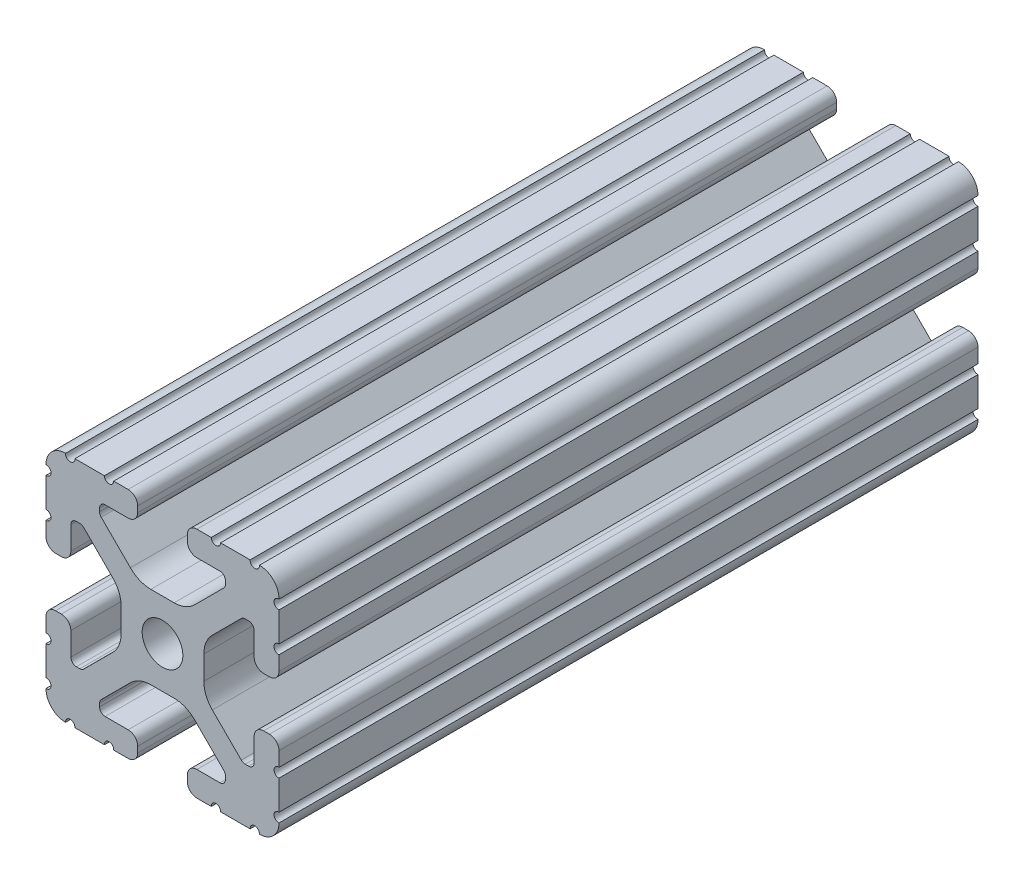
from build123d import *

# Parameters (mm, degrees)
SKETCH1_R      = 3.3274
EXTRUDE1_DEPTH = 114.3


with BuildPart() as part:
    # Sketch1 → Extrude1 (new body)
    with BuildSketch(Plane.XY):
        with BuildLine():
            Line((-10.022898969, 12.91475973), (-5.252158105, 8.144007132))
            ThreePointArc((-5.252158105, 8.144007132), (-3.715177372, 7.117027388), (-1.902183975, 6.7564))
            Line((-1.902183975, 6.7564), (1.902183975, 6.7564))
            ThreePointArc((1.902183975, 6.7564), (3.715177372, 7.117027388), (5.252158105, 8.144007132))
            Line((5.252158105, 8.144007132), (10.022898969, 12.91475973))
            ThreePointArc((10.022898969, 12.91475973), (10.218362387, 13.207291992), (10.287, 13.552357131))
            Line((10.287, 13.552357131), (10.287, 14.0843))
            ThreePointArc((10.287, 14.0843), (10.022898185, 14.721898185), (9.3853, 14.986))
            Line((9.3853, 14.986), (5.617617549, 14.986))
            ThreePointArc((5.617617549, 14.986), (4.519044045, 15.441044045), (4.064, 16.539617549))
            Line((4.064, 16.539617549), (4.064, 17.496382451))
            ThreePointArc((4.064, 17.496382451), (4.519044045, 18.594955955), (5.617617549, 19.05))
            Line((5.617617549, 19.05), (7.974178704, 19.05))
            ThreePointArc((7.974178704, 19.05), (8.736178704, 18.288), (9.498178704, 19.05))
            Line((9.498178704, 19.05), (14.327719207, 19.05))
            ThreePointArc((14.327719207, 19.05), (15.087603123, 18.231251131), (15.847487039, 19.05))
            ThreePointArc((15.847487039, 19.05), (18.120176289, 18.120192083), (19.05, 15.847509295))
            ThreePointArc((19.05, 15.847509295), (18.231250992, 15.08762539), (19.05, 14.327741484))
            Line((19.05, 14.327741484), (19.05, 9.496091471))
            ThreePointArc((19.05, 9.496091471), (18.231250992, 8.736207565), (19.05, 7.97632366))
            Line((19.05, 7.97632366), (19.05, 5.617617549))
            ThreePointArc((19.05, 5.617617549), (18.594955955, 4.519044045), (17.496382451, 4.064))
            Line((17.496382451, 4.064), (16.539617549, 4.064))
            ThreePointArc((16.539617549, 4.064), (15.441044045, 4.519044045), (14.986, 5.617617549))
            Line((14.986, 5.617617549), (14.986, 9.385342516))
            ThreePointArc((14.986, 9.385342516), (14.721898185, 10.022940701), (14.0843, 10.287042516))
            Line((14.0843, 10.287042516), (13.516042086, 10.287042516))
            ThreePointArc((13.516042086, 10.287042516), (13.170975923, 10.218404478), (12.878443117, 10.022939917))
            Line((12.878443117, 10.022939917), (8.14758008, 5.292065243))
            ThreePointArc((8.14758008, 5.292065243), (7.117955879, 3.751120653), (6.7564, 1.933453584))
            Line((6.7564, 1.933453584), (6.7564, -1.933453584))
            ThreePointArc((6.7564, -1.933453584), (7.117955879, -3.751120653), (8.14758008, -5.292065243))
            Line((8.14758008, -5.292065243), (12.878443117, -10.022939917))
            ThreePointArc((12.878443117, -10.022939917), (13.170975923, -10.218404478), (13.516042086, -10.287042516))
            Line((13.516042086, -10.287042516), (14.0843, -10.287042516))
            ThreePointArc((14.0843, -10.287042516), (14.721898185, -10.022940701), (14.986, -9.385342516))
            Line((14.986, -9.385342516), (14.986, -5.617617549))
            ThreePointArc((14.986, -5.617617549), (15.441044045, -4.519044045), (16.539617549, -4.064))
            Line((16.539617549, -4.064), (17.496382451, -4.064))
            ThreePointArc((17.496382451, -4.064), (18.594955955, -4.519044045), (19.05, -5.617617549))
            Line((19.05, -5.617617549), (19.05, -7.976318491))
            ThreePointArc((19.05, -7.976318491), (18.231250992, -8.736202396), (19.05, -9.496086302))
            Line((19.05, -9.496086302), (19.05, -14.32774291))
            ThreePointArc((19.05, -14.32774291), (18.231250992, -15.087626816), (19.05, -15.847510721))
            ThreePointArc((19.05, -15.847510721), (18.120175716, -18.120192644), (15.847486868, -19.05))
            ThreePointArc((15.847486868, -19.05), (15.087602952, -18.231251131), (14.327719036, -19.05))
            Line((14.327719036, -19.05), (9.496062448, -19.05))
            ThreePointArc((9.496062448, -19.05), (8.736178532, -18.231251131), (7.976294616, -19.05))
            Line((7.976294616, -19.05), (5.617617549, -19.05))
            ThreePointArc((5.617617549, -19.05), (4.519044045, -18.594955955), (4.064, -17.496382451))
            Line((4.064, -17.496382451), (4.064, -16.539617549))
            ThreePointArc((4.064, -16.539617549), (4.519044045, -15.441044045), (5.617617549, -14.986))
            Line((5.617617549, -14.986), (9.3853, -14.986))
            ThreePointArc((9.3853, -14.986), (10.022898185, -14.721898185), (10.287, -14.0843))
            Line((10.287, -14.0843), (10.287, -13.552357131))
            ThreePointArc((10.287, -13.552357131), (10.218362387, -13.207291992), (10.022898969, -12.91475973))
            Line((10.022898969, -12.91475973), (5.252158105, -8.144007132))
            ThreePointArc((5.252158105, -8.144007132), (3.715177372, -7.117027388), (1.902183975, -6.7564))
            Line((1.902183975, -6.7564), (-1.902183975, -6.7564))
            ThreePointArc((-1.902183975, -6.7564), (-3.715177372, -7.117027388), (-5.252158105, -8.144007132))
            Line((-5.252158105, -8.144007132), (-10.022898969, -12.91475973))
            ThreePointArc((-10.022898969, -12.91475973), (-10.218362387, -13.207291992), (-10.287, -13.552357131))
            Line((-10.287, -13.552357131), (-10.287, -14.0843))
            ThreePointArc((-10.287, -14.0843), (-10.022898185, -14.721898185), (-9.3853, -14.986))
            Line((-9.3853, -14.986), (-5.617617549, -14.986))
            ThreePointArc((-5.617617549, -14.986), (-4.519044045, -15.441044045), (-4.064, -16.539617549))
            Line((-4.064, -16.539617549), (-4.064, -17.496382451))
            ThreePointArc((-4.064, -17.496382451), (-4.519044045, -18.594955955), (-5.617617549, -19.05))
            Line((-5.617617549, -19.05), (-7.976294616, -19.05))
            ThreePointArc((-7.976294616, -19.05), (-8.736178532, -18.231251131), (-9.496062448, -19.05))
            Line((-9.496062448, -19.05), (-14.327719036, -19.05))
            ThreePointArc((-14.327719036, -19.05), (-15.087602952, -18.231251131), (-15.847486868, -19.05))
            ThreePointArc((-15.847486868, -19.05), (-18.120175716, -18.120192644), (-19.05, -15.847510721))
            ThreePointArc((-19.05, -15.847510721), (-18.231250992, -15.087626816), (-19.05, -14.32774291))
            Line((-19.05, -14.32774291), (-19.05, -9.496086302))
            ThreePointArc((-19.05, -9.496086302), (-18.231250992, -8.736202396), (-19.05, -7.976318491))
            Line((-19.05, -7.976318491), (-19.05, -5.617617549))
            ThreePointArc((-19.05, -5.617617549), (-18.594955955, -4.519044045), (-17.496382451, -4.064))
            Line((-17.496382451, -4.064), (-16.539617549, -4.064))
            ThreePointArc((-16.539617549, -4.064), (-15.441044045, -4.519044045), (-14.986, -5.617617549))
            Line((-14.986, -5.617617549), (-14.986, -9.385342516))
            ThreePointArc((-14.986, -9.385342516), (-14.721898185, -10.022940701), (-14.0843, -10.287042516))
            Line((-14.0843, -10.287042516), (-13.516042086, -10.287042516))
            ThreePointArc((-13.516042086, -10.287042516), (-13.170975923, -10.218404478), (-12.878443117, -10.022939917))
            Line((-12.878443117, -10.022939917), (-8.14758008, -5.292065243))
            ThreePointArc((-8.14758008, -5.292065243), (-7.117955879, -3.751120653), (-6.7564, -1.933453584))
            Line((-6.7564, -1.933453584), (-6.7564, 1.933453584))
            ThreePointArc((-6.7564, 1.933453584), (-7.117955879, 3.751120653), (-8.14758008, 5.292065243))
            Line((-8.14758008, 5.292065243), (-12.878443117, 10.022939917))
            ThreePointArc((-12.878443117, 10.022939917), (-13.170975923, 10.218404478), (-13.516042086, 10.287042516))
            Line((-13.516042086, 10.287042516), (-14.0843, 10.287042516))
            ThreePointArc((-14.0843, 10.287042516), (-14.721898185, 10.022940701), (-14.986, 9.385342516))
            Line((-14.986, 9.385342516), (-14.986, 5.617617549))
            ThreePointArc((-14.986, 5.617617549), (-15.441044045, 4.519044045), (-16.539617549, 4.064))
            Line((-16.539617549, 4.064), (-17.496382451, 4.064))
            ThreePointArc((-17.496382451, 4.064), (-18.594955955, 4.519044045), (-19.05, 5.617617549))
            Line((-19.05, 5.617617549), (-19.05, 7.97632366))
            ThreePointArc((-19.05, 7.97632366), (-18.231250992, 8.736207565), (-19.05, 9.496091471))
            Line((-19.05, 9.496091471), (-19.05, 14.327741484))
            ThreePointArc((-19.05, 14.327741484), (-18.231250992, 15.08762539), (-19.05, 15.847509295))
            ThreePointArc((-19.05, 15.847509295), (-18.120176289, 18.120192083), (-15.847487039, 19.05))
            ThreePointArc((-15.847487039, 19.05), (-15.087603123, 18.231251131), (-14.327719207, 19.05))
            Line((-14.327719207, 19.05), (-9.498178704, 19.05))
            ThreePointArc((-9.498178704, 19.05), (-8.736178704, 18.288), (-7.974178704, 19.05))
            Line((-7.974178704, 19.05), (-5.617617549, 19.05))
            ThreePointArc((-5.617617549, 19.05), (-4.519044045, 18.594955955), (-4.064, 17.496382451))
            Line((-4.064, 17.496382451), (-4.064, 16.539617549))
            ThreePointArc((-4.064, 16.539617549), (-4.519044045, 15.441044045), (-5.617617549, 14.986))
            Line((-5.617617549, 14.986), (-9.3853, 14.986))
            ThreePointArc((-9.3853, 14.986), (-10.022898185, 14.721898185), (-10.287, 14.0843))
            Line((-10.287, 14.0843), (-10.287, 13.552357131))
            ThreePointArc((-10.287, 13.552357131), (-10.218362387, 13.207291992), (-10.022898969, 12.91475973))
        make_face()
        Circle(SKETCH1_R, mode=Mode.SUBTRACT)
    extrude(amount=-EXTRUDE1_DEPTH)


solid = part.part
